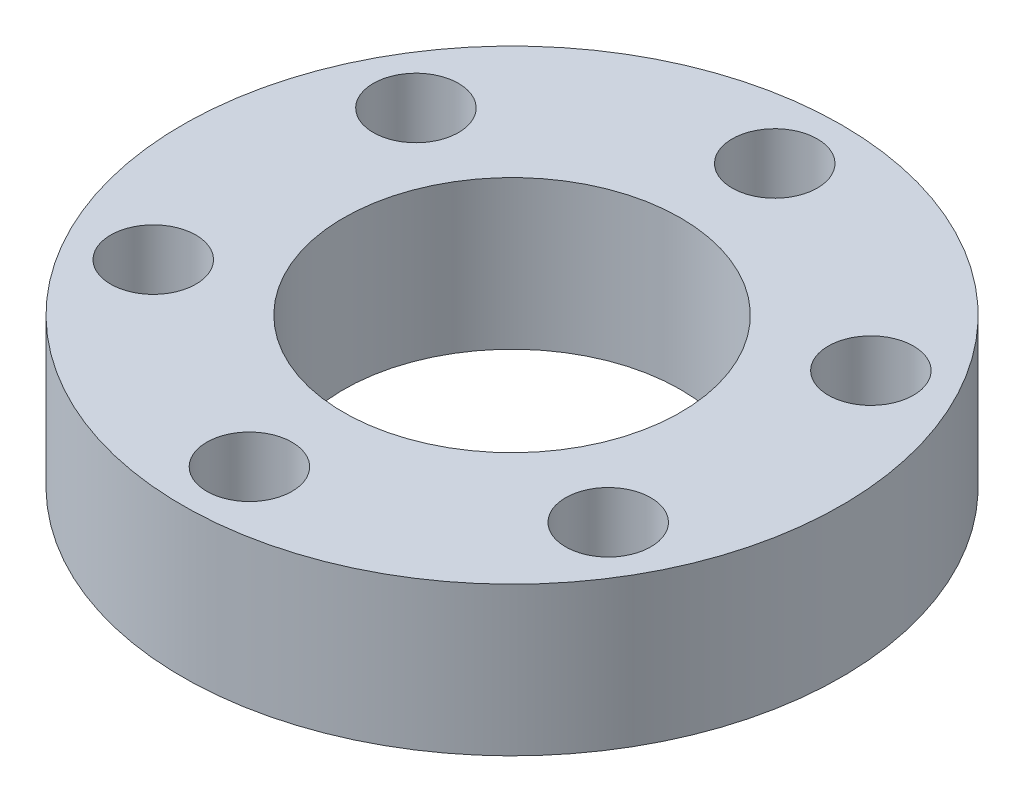
from build123d import *

# Parameters (mm, degrees)
SKETCH1_R          = 16.891
EXTRUDE1_DEPTH     = 7.62
SKETCH2_R          = 8.636
CUT_EXTRUDE4_DEPTH = 26.073415443
SKETCH3_R          = 2.1844
CUT_EXTRUDE6_DEPTH = 7.62
CIRPATTERN1_COUNT  = 6


with BuildPart() as part:
    # Sketch1 → Extrude1 (new body)
    with BuildSketch(Plane(origin=(0, 0, 0), x_dir=(1, 0, 0), z_dir=(0, 1, 0))):
        Circle(SKETCH1_R)
    extrude(amount=EXTRUDE1_DEPTH)

    # Sketch2 → Cut-Extrude4 (cut, through all)
    with BuildSketch(Plane(origin=(0, 0, 0), x_dir=(1, 0, 0), z_dir=(0, 1, 0))):
        Circle(SKETCH2_R)
    extrude(amount=CUT_EXTRUDE4_DEPTH, mode=Mode.SUBTRACT)

    # Sketch3 → Cut-Extrude6 (cut)
    with BuildSketch(Plane(origin=(0, 0, 0), x_dir=(1, 0, 0), z_dir=(0, 1, 0))):
        with Locations((0, 13.462)):
            Circle(SKETCH3_R)
    cut_extrude6 = extrude(amount=CUT_EXTRUDE6_DEPTH, mode=Mode.SUBTRACT)

    # CirPattern1: Cut-Extrude6 ×6 about axis
    cirpattern1_axis = Axis((0, 17.342311411, 0), (0, -1, 0))
    for i in range(1, CIRPATTERN1_COUNT):
        add(cut_extrude6.rotate(cirpattern1_axis, i * 360 / CIRPATTERN1_COUNT), mode=Mode.SUBTRACT)


solid = part.part
